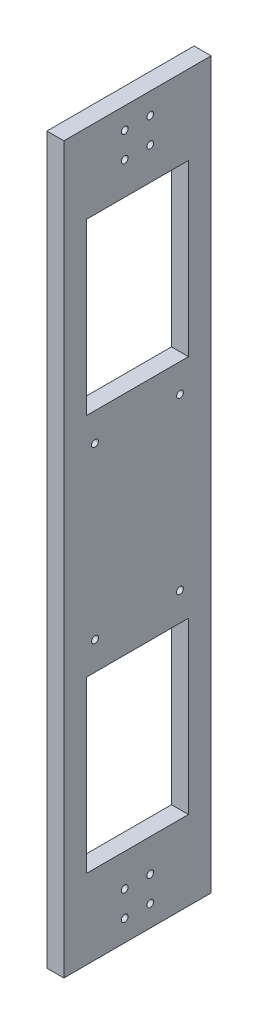
from build123d import *

# Parameters (mm, degrees)
SKETCH1_W             = 52
SKETCH1_H             = 256
BOSS_EXTRUDE1_DEPTH   = 6
M2_CLEARANCE_HOLE1_D  = 2.4
M2_CLEARANCE_HOLE2_D  = 2.4
M2_CLEARANCE_HOLE3_D  = 2.4
M2_CLEARANCE_HOLE4_D  = 2.4
M2_CLEARANCE_HOLE5_D  = 2.4
M2_CLEARANCE_HOLE6_D  = 2.4
M2_CLEARANCE_HOLE7_D  = 2.4
M2_CLEARANCE_HOLE8_D  = 2.4
M2_CLEARANCE_HOLE9_D  = 2.4
M2_CLEARANCE_HOLE10_D = 2.4
M2_CLEARANCE_HOLE11_D = 2.4
M2_CLEARANCE_HOLE12_D = 2.4
SKETCH26_W            = 36
SKETCH26_H            = 60
CUT_EXTRUDE2_DEPTH    = 6
SKETCH27_W            = 36
SKETCH27_H            = 60
CUT_EXTRUDE4_DEPTH    = 6


with BuildPart() as part:
    # Sketch1 → Boss-Extrude1 (new body)
    with BuildSketch(Plane(origin=(-157.1, 0, 0), x_dir=(0, 0, -1), z_dir=(1, 0, 0))):
        Rectangle(SKETCH1_W, SKETCH1_H)
    extrude(amount=BOSS_EXTRUDE1_DEPTH)

    # M2 Clearance Hole1 (through all)
    with Locations(Plane.ZY.offset(157.1)):
        with Locations((-4.5, 111.5)):
            Hole(M2_CLEARANCE_HOLE1_D / 2)

    # M2 Clearance Hole2 (through all)
    with Locations(Plane.ZY.offset(157.1)):
        with Locations((4.5, 111.5)):
            Hole(M2_CLEARANCE_HOLE2_D / 2)

    # M2 Clearance Hole3 (through all)
    with Locations(Plane.ZY.offset(157.1)):
        with Locations((-4.5, 120.5)):
            Hole(M2_CLEARANCE_HOLE3_D / 2)

    # M2 Clearance Hole4 (through all)
    with Locations(Plane.ZY.offset(157.1)):
        with Locations((4.5, 120.5)):
            Hole(M2_CLEARANCE_HOLE4_D / 2)

    # M2 Clearance Hole5 (through all)
    with Locations(Plane.ZY.offset(157.1)):
        with Locations((-4.5, -120.5)):
            Hole(M2_CLEARANCE_HOLE5_D / 2)

    # M2 Clearance Hole6 (through all)
    with Locations(Plane.ZY.offset(157.1)):
        with Locations((4.5, -120.5)):
            Hole(M2_CLEARANCE_HOLE6_D / 2)

    # M2 Clearance Hole7 (through all)
    with Locations(Plane.ZY.offset(157.1)):
        with Locations((-4.5, -111.5)):
            Hole(M2_CLEARANCE_HOLE7_D / 2)

    # M2 Clearance Hole8 (through all)
    with Locations(Plane.ZY.offset(157.1)):
        with Locations((4.5, -111.5)):
            Hole(M2_CLEARANCE_HOLE8_D / 2)

    # M2 Clearance Hole9 (through all)
    with Locations(Plane.ZY.offset(157.1)):
        with Locations((-15, -30)):
            Hole(M2_CLEARANCE_HOLE9_D / 2)

    # M2 Clearance Hole10 (through all)
    with Locations(Plane.ZY.offset(157.1)):
        with Locations((15, -30)):
            Hole(M2_CLEARANCE_HOLE10_D / 2)

    # M2 Clearance Hole11 (through all)
    with Locations(Plane.ZY.offset(157.1)):
        with Locations((-15, 30)):
            Hole(M2_CLEARANCE_HOLE11_D / 2)

    # M2 Clearance Hole12 (through all)
    with Locations(Plane.ZY.offset(157.1)):
        with Locations((15, 30)):
            Hole(M2_CLEARANCE_HOLE12_D / 2)

    # Sketch26 → Cut-Extrude2 (cut)
    with BuildSketch(Plane(origin=(-157.1, 0, 0), x_dir=(0, 0, -1), z_dir=(1, 0, 0))):
        with Locations((0, 70)):
            Rectangle(SKETCH26_W, SKETCH26_H)
    extrude(amount=CUT_EXTRUDE2_DEPTH, mode=Mode.SUBTRACT)

    # Sketch27 → Cut-Extrude4 (cut)
    with BuildSketch(Plane(origin=(-157.1, 0, 0), x_dir=(0, 0, -1), z_dir=(1, 0, 0))):
        with Locations((0, -70)):
            Rectangle(SKETCH27_W, SKETCH27_H)
    extrude(amount=CUT_EXTRUDE4_DEPTH, mode=Mode.SUBTRACT)


solid = part.part
